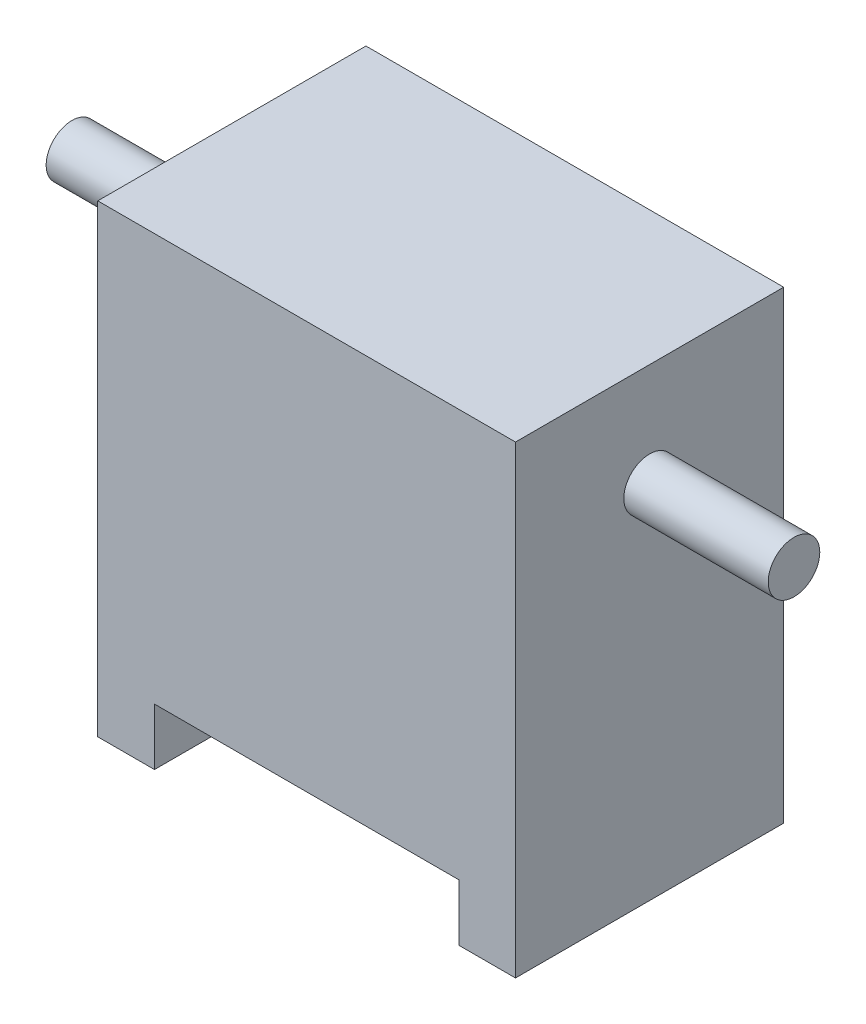
from build123d import *

# Parameters (mm, degrees)
SKETCH_1_W           = 40.5
SKETCH_1_H           = 45
EXTRUDE_1_DEPTH      = 26
SKETCH_2_W           = 29.5
SKETCH_2_H           = 5.5
CUT_EXTRUDE_1_DEPTH  = 38
EXTRUDE_2_DEPTH      = 14
EXTRUDE_2_DEPTH_BACK = 56
SKETCH_3_R           = 2.5


with BuildPart() as part:
    # 草图1 → 凸台-拉伸1 (new body)
    with BuildSketch(Plane.XY):
        with Locations((20.25, -22.5)):
            Rectangle(SKETCH_1_W, SKETCH_1_H)
    extrude(amount=EXTRUDE_1_DEPTH)

    # 草图2 → 切除-拉伸1 (cut)
    with BuildSketch(Plane.XY.offset(26)):
        with Locations((20.25, -42.25)):
            Rectangle(SKETCH_2_W, SKETCH_2_H)
    extrude(amount=-CUT_EXTRUDE_1_DEPTH, mode=Mode.SUBTRACT)

    # 草图3 → 凸台-拉伸2 (add, two sides: drawn at the far end of the back side and taken through both)
    with BuildSketch(Plane(origin=(40.5, 0, 0), x_dir=(0, 0, -1), z_dir=(1, 0, 0)).offset(-EXTRUDE_2_DEPTH_BACK)):
        with Locations((-13, -10)):
            Circle(SKETCH_3_R)
    extrude(amount=EXTRUDE_2_DEPTH + EXTRUDE_2_DEPTH_BACK)


solid = part.part
